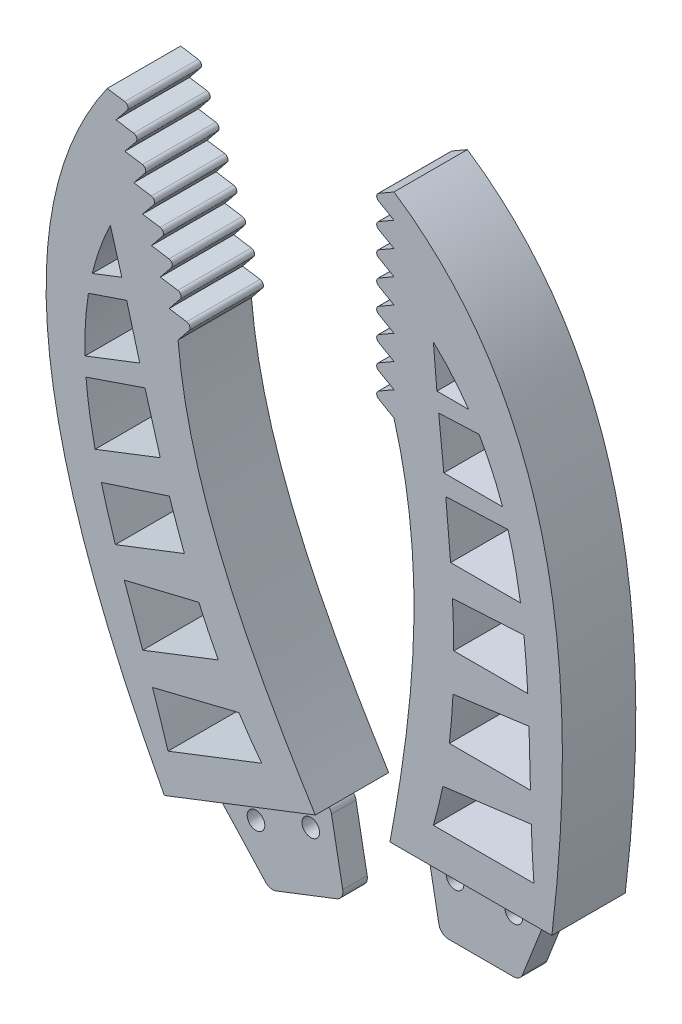
from build123d import *

# Parameters (mm, degrees)
SKETCH_2_R      = 1.8
EXTRUDE_1_DEPTH = 5
EXTRUDE_2_DEPTH = 15
EXTRUDE_5_DEPTH = 15


with BuildPart() as part:
    # 草图2 → 凸台-拉伸1 (new body)
    with BuildSketch(Plane.XY):
        with BuildLine():
            Line((1.660431991, 0), (14.915948235, 0))
            ThreePointArc((14.915948235, 0), (16.042856147, 0.347705063), (16.777932472, 1.269921443))
            Line((16.777932472, 1.269921443), (21.569358625, 13.489921443))
            ThreePointArc((21.569358625, 13.489921443), (21.359669324, 15.346907912), (19.707374388, 16.22))
            Line((19.707374388, 16.22), (-0.626478849, 16.22))
            ThreePointArc((-0.626478849, 16.22), (-2.165277959, 15.497535635), (-2.592349547, 13.852097299))
            Line((-2.592349547, 13.852097299), (-0.305438707, 1.632097299))
            ThreePointArc((-0.305438707, 1.632097299), (0.382896356, 0.46120089), (1.660431991, 0))
        make_face()
        with Locations((2.987038617, 11.22)):
            Circle(SKETCH_2_R, mode=Mode.SUBTRACT)
        with Locations((14.987038617, 11.22)):
            Circle(SKETCH_2_R, mode=Mode.SUBTRACT)
    extrude(amount=EXTRUDE_1_DEPTH)

    # 草图3 → 凸台-拉伸2 (add)
    with BuildSketch(Plane(origin=(0, 0, -5), x_dir=(-1, 0, 0), z_dir=(0, 0, -1))):
        with BuildLine():
            Line((0.626478849, 16.22), (-27.772557769, 16.22))
            add(Edge.make_bspline(
                [(-27.772557769, 16.22), (-32.493161142, 55.467514505), (-32.453573251, 107.077187546), (4.491826918, 131.663635033)],
                knots=[0, 0, 0, 0, 1, 1, 1, 1], degree=3))
            Line((4.491826918, 131.663635033), (7.621953937, 129.856455356))
            ThreePointArc((7.621953937, 129.856455356), (8.021953937, 129.163635033), (7.621953937, 128.47081471))
            Line((7.621953937, 128.47081471), (4.491826918, 126.663635033))
            Line((4.491826918, 126.663635033), (7.621953937, 124.856455356))
            ThreePointArc((7.621953937, 124.856455356), (8.021953937, 124.163635033), (7.621953937, 123.47081471))
            Line((7.621953937, 123.47081471), (4.491826918, 121.663635033))
            Line((4.491826918, 121.663635033), (7.621953937, 119.856455356))
            ThreePointArc((7.621953937, 119.856455356), (8.021953937, 119.163635033), (7.621953937, 118.47081471))
            Line((7.621953937, 118.47081471), (4.491826918, 116.663635033))
            Line((4.491826918, 116.663635033), (7.621953937, 114.856455356))
            ThreePointArc((7.621953937, 114.856455356), (8.021953937, 114.163635033), (7.621953937, 113.47081471))
            Line((7.621953937, 113.47081471), (4.491826918, 111.663635033))
            Line((4.491826918, 111.663635033), (7.621953937, 109.856455356))
            ThreePointArc((7.621953937, 109.856455356), (8.021953937, 109.163635033), (7.621953937, 108.47081471))
            Line((7.621953937, 108.47081471), (4.491826918, 106.663635033))
            Line((4.491826918, 106.663635033), (7.621953937, 104.856455356))
            ThreePointArc((7.621953937, 104.856455356), (8.021953937, 104.163635033), (7.621953937, 103.47081471))
            Line((7.621953937, 103.47081471), (4.491826918, 101.663635033))
            Line((4.491826918, 101.663635033), (7.621953937, 99.856455356))
            ThreePointArc((7.621953937, 99.856455356), (8.021953937, 99.163635033), (7.621953937, 98.47081471))
            Line((7.621953937, 98.47081471), (4.491826918, 96.663635033))
            Line((4.491826918, 96.663635033), (7.621953937, 94.856455356))
            ThreePointArc((7.621953937, 94.856455356), (8.021953937, 94.163635033), (7.621953937, 93.47081471))
            Line((7.621953937, 93.47081471), (4.491826918, 91.663635033))
            add(Edge.make_bspline(
                [(4.491826918, 91.663635033), (-2.585061361, 67.200896114), (0.71837459, 40.719953967), (5.318915354, 16.22)],
                knots=[0, 0, 0, 0, 1, 1, 1, 1], degree=3))
            Line((5.318915354, 16.22), (0.626478849, 16.22))
        make_face()
        with BuildLine():
            Line((-24.103793947, 23.611753626), (-3.558151587, 23.611753626))
            add(Edge.make_bspline(
                [(-3.558151587, 109.163635033), (-5.686658434, 80.926006258), (-11.766718861, 51.527422298), (-3.558151587, 23.611753626)],
                knots=[0, 0, 0, 0, 1, 1, 1, 1], degree=3))
            add(Edge.make_bspline(
                [(-24.103793947, 23.611753626), (-21.850459894, 52.365247382), (-27.030900624, 87.116027421), (-3.558151587, 109.163635033)],
                knots=[0, 0, 0, 0, 1, 1, 1, 1], degree=3))
        make_face(mode=Mode.SUBTRACT)
    extrude(amount=-EXTRUDE_2_DEPTH)

    # 草图5 → 凸台-拉伸5 (add)
    with BuildSketch(Plane(origin=(0, 0, -5), x_dir=(-1, 0, 0), z_dir=(0, 0, -1))):
        Polygon((-24.90873618, 33.973407672), (-5.501898334, 31.48416344), (-5.501898334, 39.73186798), (-24.90873618, 39.73186798), align=None)
        Polygon((-23.143478751, 56.560655466), (-7.569292502, 56.560655466), (-7.569292502, 48.820808614), (-23.143478751, 50.909210821), align=None)
        Polygon((-22.587551241, 71.85955318), (-5.89003254, 71.85955318), (-5.89003254, 65.622310266), (-22.587551241, 66.555478816), align=None)
        Polygon((-21.158331295, 87.040767066), (-4.722301911, 87.040767066), (-4.722301911, 82.991082355), (-21.158331295, 83.672807658), align=None)
        Polygon((-13.516443103, 100.809775009), (-3.173980303, 100.809775009), (-3.173980303, 97.044879708), (-13.516443103, 97.489249071), align=None)
    extrude(amount=-EXTRUDE_5_DEPTH)


with BuildPart() as body_2:
    # 镜向3: mirrored copy
    add(part.part.mirror(Plane(origin=(-9.829353491, -1.839513506, 0), x_dir=(0, 0, 1), z_dir=(-0.9829353491495536, -0.18395135061272394, 0))))


solid = Compound([part.part, body_2.part])
